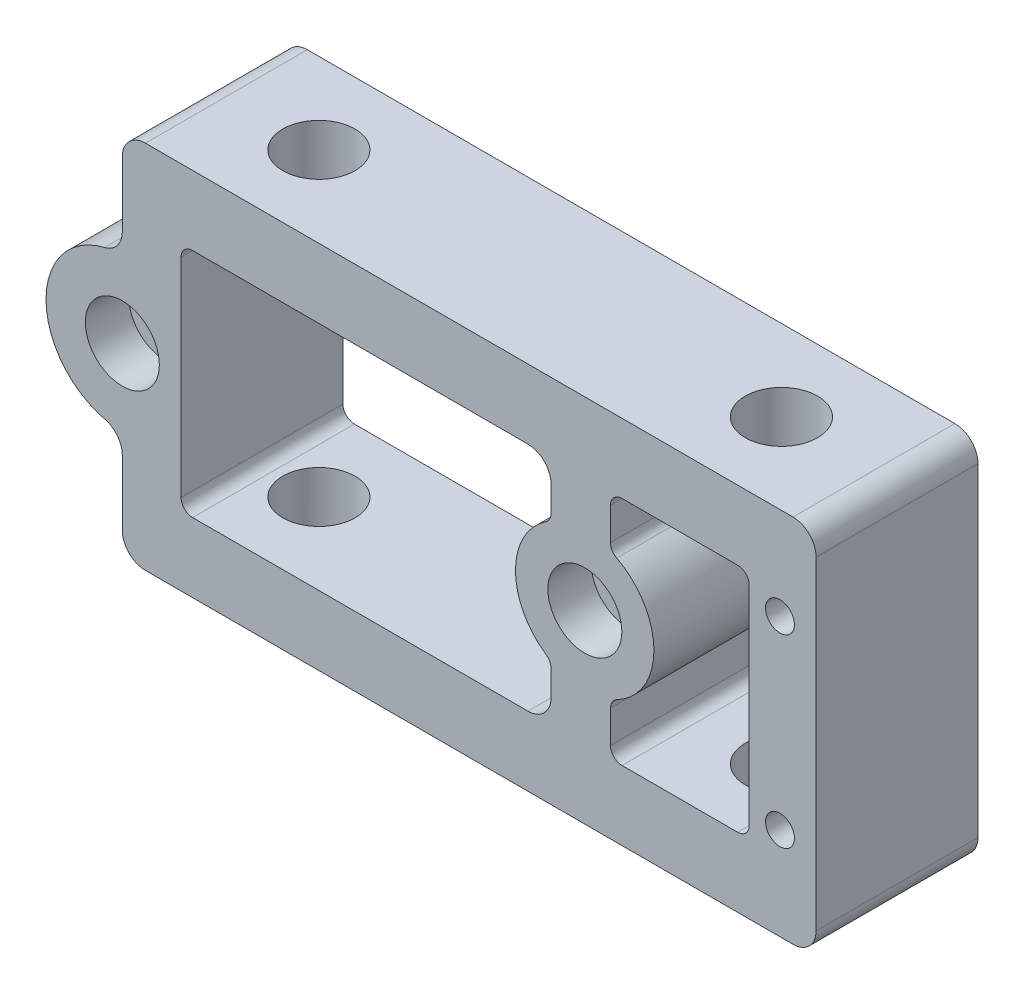
from build123d import *

# Parameters (mm, degrees)
SKETCH1_W           = 93.6625
SKETCH1_H           = 40.64
SKETCH1_R           = 2.4892
SKETCH1_R_2         = 1.5875
BOSS_EXTRUDE1_DEPTH = 17.78
SKETCH6_R           = 3.96875
CUT_EXTRUDE4_DEPTH  = 104.635910312
CUT_EXTRUDE3_DEPTH  = 17.78
FILLET1_R           = 2.54
SKETCH3_R           = 4.064
CUT_EXTRUDE5_DEPTH  = 4.7752
SKETCH7_W           = 9.113549332
SKETCH7_H           = 21.245092044
CUT_EXTRUDE6_DEPTH  = 98.141100599
SKETCH8_W           = 17.78
SKETCH8_H           = 25.4
CUT_EXTRUDE7_DEPTH  = 17.78
FILLET2_R           = 1.27


with BuildPart() as part:
    # Sketch1 → Boss-Extrude1 (new body)
    with BuildSketch(Plane.XY):
        with Locations((-46.83125, 0)):
            Rectangle(SKETCH1_W, SKETCH1_H)
        with Locations((-84.93125, 0)):
            Circle(SKETCH1_R, mode=Mode.SUBTRACT)
        with Locations((-34.13125, 0)):
            Circle(SKETCH1_R, mode=Mode.SUBTRACT)
        with Locations((-12.7, 10.16)):
            Circle(SKETCH1_R_2, mode=Mode.SUBTRACT)
        with Locations((-12.7, -10.16)):
            Circle(SKETCH1_R_2, mode=Mode.SUBTRACT)
    extrude(amount=-BOSS_EXTRUDE1_DEPTH)

    # Sketch6 → Cut-Extrude4 (cut, through all)
    with BuildSketch(Plane(origin=(0, 20.32, 0), x_dir=(1, 0, 0), z_dir=(0, 1, 0))):
        with Locations(Location((-72.23125, 8.89, 0), (0, 0, 270))):
            Circle(SKETCH6_R)
        with Locations(Location((-21.43125, 8.89, 0), (0, 0, 270))):
            Circle(SKETCH6_R)
    extrude(amount=-CUT_EXTRUDE4_DEPTH, mode=Mode.SUBTRACT)

    # Sketch5 → Cut-Extrude3 (cut)
    with BuildSketch(Plane.XY):
        with BuildLine():
            Line((-93.6625, -20.32), (-93.6625, 20.32))
            Line((-93.6625, 20.32), (-84.93125, 20.32))
            Line((-84.93125, 20.32), (-84.93125, 10.622546022))
            ThreePointArc((-84.93125, 10.622546022), (-85.477262526, 9.049137635), (-86.880552326, 8.152186482))
            ThreePointArc((-86.880552326, 8.152186482), (-93.31325, 0), (-86.880552326, -8.152186482))
            ThreePointArc((-86.880552326, -8.152186482), (-85.477262526, -9.049137635), (-84.93125, -10.622546022))
            Line((-84.93125, -10.622546022), (-84.93125, -20.32))
            Line((-84.93125, -20.32), (-93.6625, -20.32))
        make_face()
        with BuildLine():
            Line((0, -20.32), (0, 20.32))
            Line((0, 20.32), (-8.73125, 20.32))
            Line((-8.73125, 20.32), (-8.73125, 10.622546022))
            ThreePointArc((-8.73125, 10.622546022), (-8.185237474, 9.049137635), (-6.781947674, 8.152186482))
            ThreePointArc((-6.781947674, 8.152186482), (-0.34925, 0), (-6.781947674, -8.152186482))
            ThreePointArc((-6.781947674, -8.152186482), (-8.185237474, -9.049137635), (-8.73125, -10.622546022))
            Line((-8.73125, -10.622546022), (-8.73125, -20.32))
            Line((-8.73125, -20.32), (0, -20.32))
        make_face()
    extrude(amount=-CUT_EXTRUDE3_DEPTH, mode=Mode.SUBTRACT)

    # Fillet1
    fillet1_edges = [part.edges().sort_by_distance(p)[0] for p in [
        (-84.93125, 20.32, -8.89),
        (-84.93125, -20.32, -8.89),
        (-8.73125, 20.32, -8.89),
        (-8.73125, -20.32, -8.89),
    ]]
    fillet(fillet1_edges, radius=FILLET1_R)

    # Sketch3 → Cut-Extrude5 (cut)
    with BuildSketch(Plane.XY):
        with Locations((-84.93125, 0)):
            Circle(SKETCH3_R)
        with Locations((-34.13125, 0)):
            Circle(SKETCH3_R)
    extrude(amount=-CUT_EXTRUDE5_DEPTH, mode=Mode.SUBTRACT)

    # Sketch7 → Cut-Extrude6 (cut, through all)
    with BuildSketch(Plane.XY):
        with BuildLine():
            Line((-37.842518981, 10.16), (-37.842518981, 6.655139559))
            ThreePointArc((-37.842518981, 6.655139559), (-41.75125, 0), (-37.842518981, -6.655139559))
            Line((-37.842518981, -6.655139559), (-37.842518981, -10.16))
            ThreePointArc((-37.842518981, -10.16), (-38.586467757, -11.956051224), (-40.382518981, -12.7))
            Line((-40.382518981, -12.7), (-60.702518981, -12.7))
            ThreePointArc((-60.702518981, -12.7), (-62.498570205, -11.956051224), (-63.242518981, -10.16))
            Line((-63.242518981, -10.16), (-63.242518981, 10.16))
            ThreePointArc((-63.242518981, 10.16), (-62.498570205, 11.956051224), (-60.702518981, 12.7))
            Line((-60.702518981, 12.7), (-40.382518981, 12.7))
            ThreePointArc((-40.382518981, 12.7), (-38.586467757, 11.956051224), (-37.842518981, 10.16))
        make_face()
        with Locations((-4.174475334, 0)):
            Rectangle(SKETCH7_W, SKETCH7_H)
    extrude(amount=-CUT_EXTRUDE6_DEPTH, mode=Mode.SUBTRACT)

    # Sketch8 → Cut-Extrude7 (cut)
    with BuildSketch(Plane.XY):
        with Locations((-69.592518981, 0)):
            Rectangle(SKETCH8_W, SKETCH8_H)
        with BuildLine():
            Line((-31.316413003, 12.7), (-16.076413003, 12.7))
            Line((-16.076413003, 12.7), (-16.076413003, -12.7))
            Line((-16.076413003, -12.7), (-31.316413003, -12.7))
            Line((-31.316413003, -12.7), (-31.316413003, -7.046567735))
            ThreePointArc((-31.316413003, -7.046567735), (-26.543271075, 0), (-31.316413003, 7.046567735))
            Line((-31.316413003, 7.046567735), (-31.316413003, 12.7))
        make_face()
    extrude(amount=-CUT_EXTRUDE7_DEPTH, mode=Mode.SUBTRACT)

    # Fillet2
    fillet2_edges = [part.edges().sort_by_distance(p)[0] for p in [
        (-37.842518981, 6.655139559, -8.89),
        (-37.842518981, -6.655139559, -8.89),
        (-78.482518981, 12.7, -8.89),
        (-78.482518981, -12.7, -8.89),
        (-16.076413003, -12.7, -8.89),
        (-31.316413003, 12.7, -8.89),
        (-31.316413003, -12.7, -8.89),
        (-16.076413003, 12.7, -8.89),
        (-31.316413003, 7.046567735, -8.89),
        (-31.316413003, -7.046567735, -8.89),
    ]]
    fillet(fillet2_edges, radius=FILLET2_R)


solid = part.part
